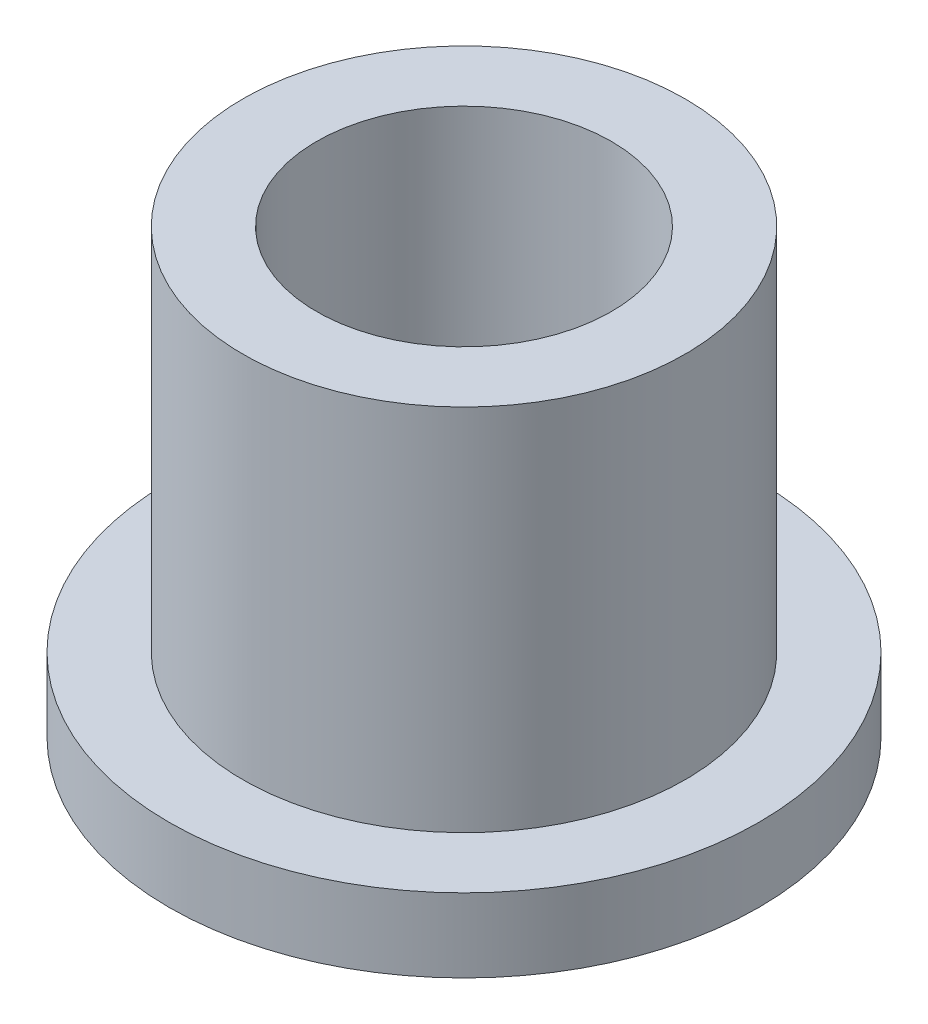
from build123d import *

# Parameters (mm, degrees)
SKETCH2_R           = 4.7625
SKETCH2_R_2         = 3.175
BOSS_EXTRUDE1_DEPTH = 9.525
SKETCH3_R           = 6.35
SKETCH3_R_2         = 4.7625
BOSS_EXTRUDE2_DEPTH = 1.5875


with BuildPart() as part:
    # Sketch2 → Boss-Extrude1 (new body)
    with BuildSketch(Plane(origin=(0, 0, 0), x_dir=(1, 0, 0), z_dir=(0, 1, 0))):
        with Locations(Location((0, 0, 0), (0, 0, 90))):
            Circle(SKETCH2_R)
        with Locations(Location((0, 0, 0), (0, 0, 90))):
            Circle(SKETCH2_R_2, mode=Mode.SUBTRACT)
    extrude(amount=BOSS_EXTRUDE1_DEPTH)

    # Sketch3 → Boss-Extrude2 (add)
    with BuildSketch(Plane(origin=(0, 0, 0), x_dir=(1, 0, 0), z_dir=(0, 1, 0))):
        with Locations(Location((0, 0, 0), (0, 0, 270))):
            Circle(SKETCH3_R)
        with Locations(Location((0, 0, 0), (0, 0, 90))):
            Circle(SKETCH3_R_2, mode=Mode.SUBTRACT)
    extrude(amount=BOSS_EXTRUDE2_DEPTH)


solid = part.part
